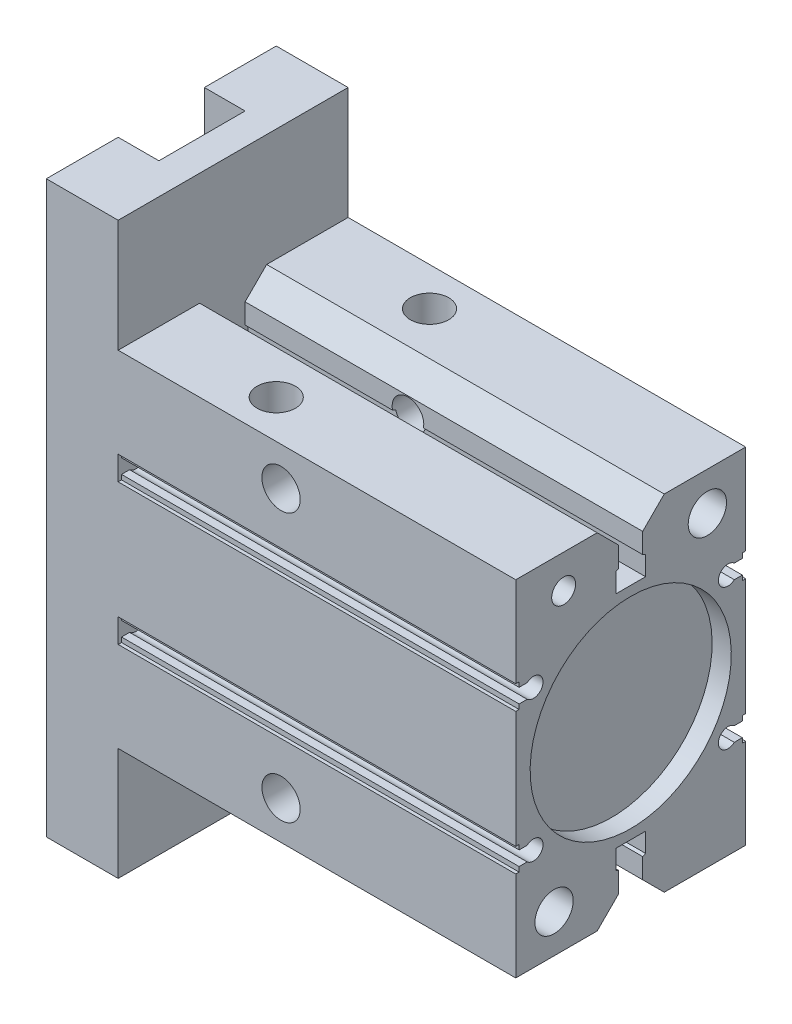
from build123d import *

# Parameters (mm, degrees)
MAIN_DEPTH                   = 24
SK_RECESS_R                  = 21
RECESS_DEPTH                 = 4
NUT_DEPTH                    = 83
SK_HOLE1_R                   = 2.5
HOLE1_DEPTH                  = 5
SK_HOLE_T_R                  = 4
HOLE_T_DEPTH                 = 17
SK_HOLE2_R                   = 4
HOLE2_DEPTH                  = 13
SK_HOLE3_R                   = 4
HOLE3_DEPTH                  = 16
SKETCH1_R                    = 3.3
THRUHOLES_DEPTH              = 113.841703284
SK_PRONG_GRV_W               = 8.5
SK_PRONG_GRV_H               = 119
PRONG_GRV_DEPTH              = 9
SK_HOLE4_R                   = 2.5
HOLE4_DEPTH                  = 5
GRV_REACH                    = 119.133
F_32_40SWITCHCHAMFER_SIZE    = 4.5
SKETCH5_W                    = 0.7
SKETCH5_H                    = 5
F_32_40SWITCHCUTDETAIL_DEPTH = 105.905910224
EXTRUDE1_START               = 5
SKETCH6_R                    = 2.5
EXTRUDE1_DEPTH               = 5
SKETCH9_R                    = 2.5
HOLE_5_DEPTH                 = 5


with BuildPart() as part:
    # sk-main → main (new, symmetric)
    with BuildSketch(Plane.XY):
        Polygon((0, -36), (83, -36), (83, 36), (0, 36), (0, 59.5), (-15, 59.5), (-15, -59.5), (0, -59.5), align=None)
    extrude(amount=MAIN_DEPTH, both=True)

    # sk-recess → recess (cut)
    with BuildSketch(Plane(origin=(83, 0, 0), x_dir=(0, 0, -1), z_dir=(1, 0, 0))):
        with Locations(Location((0, 0, 0), (0, 0, 90))):
            Circle(SK_RECESS_R)
    extrude(amount=-RECESS_DEPTH, mode=Mode.SUBTRACT)

    # sk-NUT → NUT (cut)
    with BuildSketch(Plane(origin=(83, 0, 0), x_dir=(0, 0, -1), z_dir=(1, 0, 0))):
        with BuildLine():
            Line((-21.622875656, 16.2), (-24, 16.2))
            Line((-24, 16.2), (-24, 13.2))
            Line((-24, 13.2), (-21.622875656, 13.2))
            ThreePointArc((-21.622875656, 13.2), (-18.3, 14.7), (-21.622875656, 16.2))
        make_face()
        with BuildLine():
            Line((-21.622875656, -13.2), (-24, -13.2))
            Line((-24, -13.2), (-24, -16.2))
            Line((-24, -16.2), (-21.622875656, -16.2))
            ThreePointArc((-21.622875656, -16.2), (-18.3, -14.7), (-21.622875656, -13.2))
        make_face()
        with BuildLine():
            Line((21.622875656, 13.2), (24, 13.2))
            Line((24, 13.2), (24, 16.2))
            Line((24, 16.2), (21.622875656, 16.2))
            ThreePointArc((21.622875656, 16.2), (18.3, 14.7), (21.622875656, 13.2))
        make_face()
        with BuildLine():
            Line((21.622875656, -13.2), (24, -13.2))
            Line((24, -13.2), (24, -16.2))
            Line((24, -16.2), (21.622875656, -16.2))
            ThreePointArc((21.622875656, -16.2), (18.3, -14.7), (21.622875656, -13.2))
        make_face()
    extrude(amount=-NUT_DEPTH, mode=Mode.SUBTRACT)

    # sk-hole1 → hole1 (cut)
    with BuildSketch(Plane(origin=(83, 0, 0), x_dir=(0, 0, -1), z_dir=(1, 0, 0))):
        with Locations(Location((-14, 29, 0), (0, 0, 90))):
            Circle(SK_HOLE1_R)
    extrude(amount=-HOLE1_DEPTH, mode=Mode.SUBTRACT)

    # sk-hole_t → hole_t (cut)
    with BuildSketch(Plane(origin=(83, 0, 0), x_dir=(0, 0, -1), z_dir=(1, 0, 0))):
        with Locations(Location((-16, -28, 0), (0, 0, 90))):
            Circle(SK_HOLE_T_R)
        with Locations(Location((16, 28, 0), (0, 0, 90))):
            Circle(SK_HOLE_T_R)
    extrude(amount=-HOLE_T_DEPTH, mode=Mode.SUBTRACT)

    # sk-hole2 → hole2 (cut)
    with BuildSketch(Plane(origin=(0, 36, 0), x_dir=(-1, 0, 0), z_dir=(0, 1, 0))):
        with Locations((-25, -16)):
            Circle(SK_HOLE2_R)
        with Locations((-25, 16)):
            Circle(SK_HOLE2_R)
    extrude(amount=-HOLE2_DEPTH, mode=Mode.SUBTRACT)

    # sk-hole3 → hole3 (cut)
    with BuildSketch(Plane(origin=(0, 0, -24), x_dir=(-1, 0, 0), z_dir=(0, 0, -1))):
        with Locations((-34, 28)):
            Circle(SK_HOLE3_R)
        with Locations((-34, -28)):
            Circle(SK_HOLE3_R)
    hole3 = extrude(amount=-HOLE3_DEPTH, mode=Mode.SUBTRACT)

    # Mirror1: hole3 across plane
    add(hole3.mirror(Plane.XY), mode=Mode.SUBTRACT)

    # Sketch1 → ThruHoles (cut, through all)
    with BuildSketch(Plane.XY.offset(24)):
        with Locations((34, 28)):
            Circle(SKETCH1_R)
        with Locations((34, -28)):
            Circle(SKETCH1_R)
    extrude(amount=-THRUHOLES_DEPTH, mode=Mode.SUBTRACT)

    # sk-prong_grv → prong_grv (cut, symmetric)
    with BuildSketch(Plane.XY):
        with Locations((-10.75, 0)):
            Rectangle(SK_PRONG_GRV_W, SK_PRONG_GRV_H)
    extrude(amount=PRONG_GRV_DEPTH, both=True, mode=Mode.SUBTRACT)

    # sk-hole4 → hole4 (cut)
    with BuildSketch(Plane.XZ.offset(36)):
        with Locations((45, 14)):
            Circle(SK_HOLE4_R)
        with Locations((71, -14)):
            Circle(SK_HOLE4_R)
    extrude(amount=-HOLE4_DEPTH, mode=Mode.SUBTRACT)

    # grv: up to this face of the body (flat: up to its plane)
    grv_end = Plane(part.part.faces().sort_by_distance((0, 47.75, 0))[0])
    # sk-grv → grv (cut, up to the picked face)
    with BuildSketch(Plane(origin=(83, 0, 0), x_dir=(0, 0, -1), z_dir=(1, 0, 0)), mode=Mode.PRIVATE) as grv_sk1:
        Polygon((-2.5, 36), (-2.5, 27.3), (-3.1, 27.020215405), (-3.1, 23), (3.1, 23), (3.1, 27.020215405), (2.5, 27.3), (2.5, 36), align=None)
    grv_tool1 = split(extrude(grv_sk1.sketch, amount=-GRV_REACH, mode=Mode.PRIVATE), bisect_by=grv_end, keep=Keep.BOTH, mode=Mode.PRIVATE)
    # sk-grv → grv (cut, up to the picked face)
    with BuildSketch(Plane(origin=(83, 0, 0), x_dir=(0, 0, -1), z_dir=(1, 0, 0)), mode=Mode.PRIVATE) as grv_sk2:
        Polygon((3.1, -23), (3.1, -27.020215405), (2.5, -27.3), (2.5, -36), (-2.5, -36), (-2.5, -27.3), (-3.1, -27.020215405), (-3.1, -23), align=None)
    grv_tool2 = split(extrude(grv_sk2.sketch, amount=-GRV_REACH, mode=Mode.PRIVATE), bisect_by=grv_end, keep=Keep.BOTH, mode=Mode.PRIVATE)
    add(grv_tool1.solids().sort_by(Axis((83, 29.184807, 0), (-1, 0, 0)))[0], mode=Mode.SUBTRACT)
    add(grv_tool2.solids().sort_by(Axis((83, -29.184807, 0), (-1, 0, 0)))[0], mode=Mode.SUBTRACT)

    # 32-40SwitchChamfer
    f_32_40switchchamfer_edges = [part.edges().sort_by_distance(p)[0] for p in [
        (41.5, 36, -2.5),
        (41.5, 36, 2.5),
        (41.5, -36, 2.5),
        (41.5, -36, -2.5),
    ]]
    chamfer(f_32_40switchchamfer_edges, length=F_32_40SWITCHCHAMFER_SIZE)

    # Sketch5 → 32-40SwitchCutDetail (cut, through all)
    with BuildSketch(Plane(origin=(0, 0, 0), x_dir=(0, 0, -1), z_dir=(1, 0, 0))):
        with Locations((-23.65, 14.7)):
            Rectangle(SKETCH5_W, SKETCH5_H)
        with Locations((23.65, 14.7)):
            Rectangle(SKETCH5_W, SKETCH5_H)
        with Locations((23.65, -14.7)):
            Rectangle(SKETCH5_W, SKETCH5_H)
        with Locations((-23.65, -14.7)):
            Rectangle(SKETCH5_W, SKETCH5_H)
    extrude(amount=F_32_40SWITCHCUTDETAIL_DEPTH, mode=Mode.SUBTRACT)

    # Sketch6 → Extrude1 (add)
    with BuildSketch(Plane.XZ.offset(31).offset(EXTRUDE1_START)):
        with Locations((71, -14)):
            Circle(SKETCH6_R)
    extrude(amount=-EXTRUDE1_DEPTH)

    # Sketch9 → Hole 5 (cut)
    with BuildSketch(Plane.XZ.offset(36)):
        with Locations((71, -14)):
            Circle(SKETCH9_R)
    extrude(amount=-HOLE_5_DEPTH, mode=Mode.SUBTRACT)


solid = part.part
